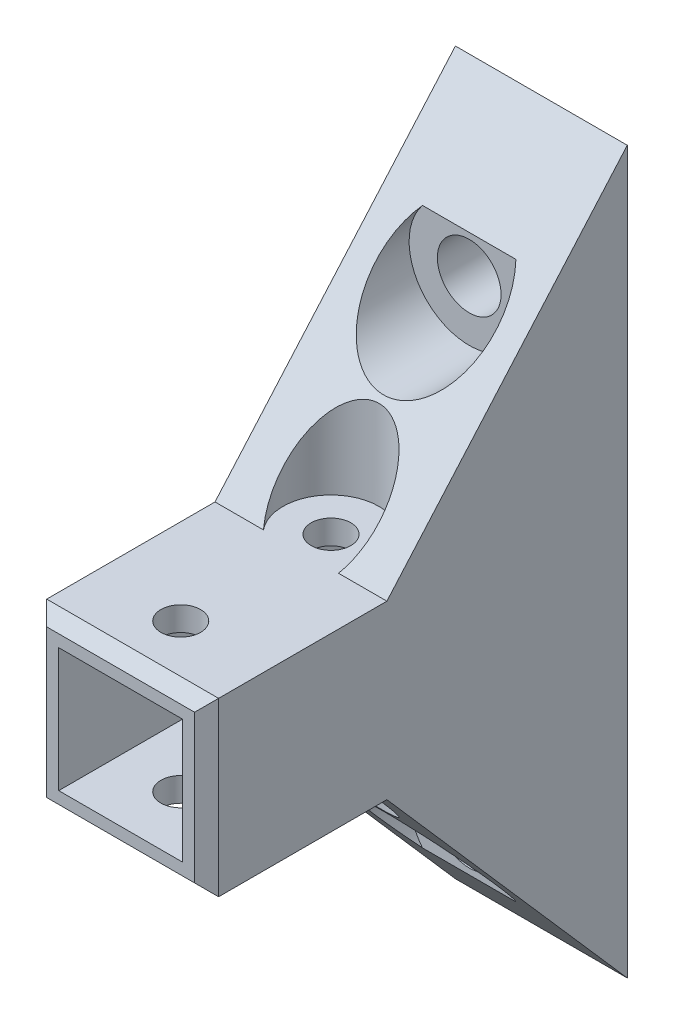
from build123d import *

# Parameters (mm, degrees)
SKETCH_1_W               = 14.3
SKETCH_1_H               = 14.3
SKETCH_1_W_2             = 10.3
SKETCH_1_H_2             = 10.3
EXTRUDE_1_DEPTH          = 35
EXTRUDE_1_2_DEPTH        = 14.3
CUT_EXTRUDE_1_DEPTH      = 52.538771813
CUT_EXTRUDE_1_DEPTH_BACK = 52.538771813
SKETCH_3_R               = 1.65
SKETCH_3_4_R             = 1.65
CUT_EXTRUDE_2_DEPTH      = 52.538771813
CUT_EXTRUDE_START        = -14.3
SKETCH_3_5_R             = 1.65
CUT_EXTRUDE_3_DEPTH      = 38.238771813
CUT_EXTRUDE_4_REACH      = 48.649
SKETCH_4_R               = 2.65
CUT_EXTRUDE_START_2      = -13.129103
SKETCH_4_3_R             = 5
CUT_EXTRUDE_5_DEPTH      = 7.129103
CHAMFER_1_SIZE           = 1


with BuildPart() as part:
    # 草图1 → Extrude 1 (new body)
    with BuildSketch(Plane.XY):
        Rectangle(SKETCH_1_W, SKETCH_1_H)
        Rectangle(SKETCH_1_W_2, SKETCH_1_H_2, mode=Mode.SUBTRACT)
    extrude(amount=EXTRUDE_1_DEPTH)

    # 草图2 → Extrude 1 2 (add)
    with BuildSketch(Plane.ZY.offset(7.15)):
        Polygon((0, 30), (0, 7.15), (20, 7.15), align=None)
        Polygon((0, -7.15), (0, -30), (20, -7.15), align=None)
    extrude(amount=-EXTRUDE_1_2_DEPTH)

    # 草图3 → 切除-拉伸1 (cut, two sides: drawn at the far end of the back side and taken through both)
    with BuildSketch(Plane.XZ.offset(7.15).offset(-CUT_EXTRUDE_1_DEPTH_BACK)):
        with Locations((0, 30)):
            Circle(SKETCH_3_R)
        with Locations(Location((0, 17.5, 0), (0, 0, 270))):
            Circle(SKETCH_3_R)
    extrude(amount=CUT_EXTRUDE_1_DEPTH + CUT_EXTRUDE_1_DEPTH_BACK, mode=Mode.SUBTRACT)

    # 草图3<4> → 切除-拉伸2 (cut, through all)
    # profile 1 of 2: a face of its own
    with BuildSketch(Plane.XZ.offset(7.15)):
        with BuildLine():
            ThreePointArc((-3.122498999, 20), (-1.324764885, 13.725745372), (4, 17.5))
            ThreePointArc((4, 17.5), (3.774254628, 18.824764885), (3.122498999, 20))
            Line((3.122498999, 20), (-3.122498999, 20))
        make_face()
        with Locations((0, 17.5)):
            Circle(SKETCH_3_4_R, mode=Mode.SUBTRACT)
    # profile 2 of 2: a face of its own
    with BuildSketch(Plane.XZ.offset(7.15)):
        with BuildLine():
            ThreePointArc((-3.122498999, 20), (-1.324764885, 13.725745372), (4, 17.5))
            ThreePointArc((4, 17.5), (3.774254628, 18.824764885), (3.122498999, 20))
            Line((3.122498999, 20), (-3.122498999, 20))
        make_face()
        with Locations((0, 17.5)):
            Circle(SKETCH_3_4_R, mode=Mode.SUBTRACT)
    extrude(amount=CUT_EXTRUDE_2_DEPTH, mode=Mode.SUBTRACT)

    # 草图3<5> → 切除-拉伸3 (cut, through all)
    # profile 1 of 2: a face of its own
    with BuildSketch(Plane.XZ.offset(7.15).offset(CUT_EXTRUDE_START)):
        with BuildLine():
            ThreePointArc((-3.122498999, 20), (-1.324764885, 13.725745372), (4, 17.5))
            ThreePointArc((4, 17.5), (3.774254628, 18.824764885), (3.122498999, 20))
            Line((3.122498999, 20), (-3.122498999, 20))
        make_face()
        with Locations((0, 17.5)):
            Circle(SKETCH_3_5_R, mode=Mode.SUBTRACT)
    # profile 2 of 2: a face of its own
    with BuildSketch(Plane.XZ.offset(7.15).offset(CUT_EXTRUDE_START)):
        with BuildLine():
            ThreePointArc((-3.122498999, 20), (-1.324764885, 13.725745372), (4, 17.5))
            ThreePointArc((4, 17.5), (3.774254628, 18.824764885), (3.122498999, 20))
            Line((3.122498999, 20), (-3.122498999, 20))
        make_face()
        with Locations((0, 17.5)):
            Circle(SKETCH_3_5_R, mode=Mode.SUBTRACT)
    extrude(amount=-CUT_EXTRUDE_3_DEPTH, mode=Mode.SUBTRACT)

    # 草图4 → 切除-拉伸4 (cut, up to next)
    with BuildSketch(Plane(origin=(0, 0, 0), x_dir=(-1, 0, 0), z_dir=(0, 0, -1)), mode=Mode.PRIVATE) as cut_extrude_4_sk1:
        with Locations((0, 20)):
            Circle(SKETCH_4_R)
    cut_extrude_4_tool1 = extrude(cut_extrude_4_sk1.sketch, amount=-CUT_EXTRUDE_4_REACH, mode=Mode.PRIVATE) & part.part
    # 草图4 → 切除-拉伸4 (cut, up to next)
    with BuildSketch(Plane(origin=(0, 0, 0), x_dir=(-1, 0, 0), z_dir=(0, 0, -1)), mode=Mode.PRIVATE) as cut_extrude_4_sk2:
        with Locations((0, -20)):
            Circle(SKETCH_4_R)
    cut_extrude_4_tool2 = extrude(cut_extrude_4_sk2.sketch, amount=-CUT_EXTRUDE_4_REACH, mode=Mode.PRIVATE) & part.part
    add(cut_extrude_4_tool1.solids().sort_by_distance((0, 20, 0))[0], mode=Mode.SUBTRACT)
    add(cut_extrude_4_tool2.solids().sort_by_distance((0, -20, 0))[0], mode=Mode.SUBTRACT)

    # 草图4<3> → 切除-拉伸5 (cut)
    with BuildSketch(Plane(origin=(0, 0, 0), x_dir=(-1, 0, 0), z_dir=(0, 0, -1)).offset(CUT_EXTRUDE_START_2)):
        with Locations((0, 20)):
            Circle(SKETCH_4_3_R)
        with Locations((0, -20)):
            Circle(SKETCH_4_3_R)
    extrude(amount=CUT_EXTRUDE_5_DEPTH, mode=Mode.SUBTRACT)

    # 倒角1
    chamfer_1_edges = [part.edges().sort_by_distance(p)[0] for p in [
        (7.15, 0, 35),
        (0, 7.15, 35),
        (-7.15, 0, 35),
        (0, -7.15, 35),
    ]]
    chamfer(chamfer_1_edges, length=CHAMFER_1_SIZE)


solid = part.part
